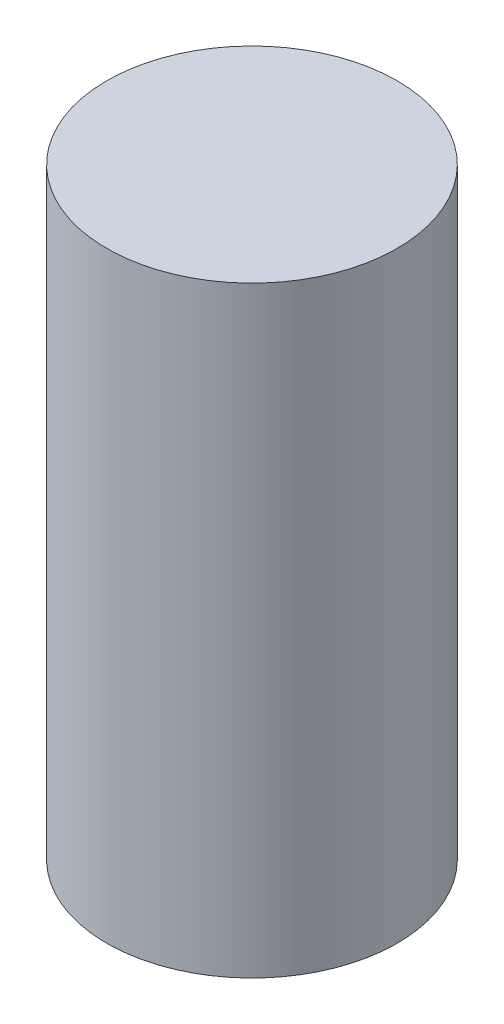
from build123d import *

# Parameters (mm, degrees)
SKETCH1_R           = 12.5
BOSS_EXTRUDE1_DEPTH = 51.8


with BuildPart() as part:
    # Sketch1 → Boss-Extrude1 (new body)
    with BuildSketch(Plane(origin=(0, 0, 0), x_dir=(1, 0, 0), z_dir=(0, 1, 0))):
        with Locations(Location((0, 0, 0), (0, 0, 90))):
            Circle(SKETCH1_R)
    extrude(amount=BOSS_EXTRUDE1_DEPTH)


solid = part.part
